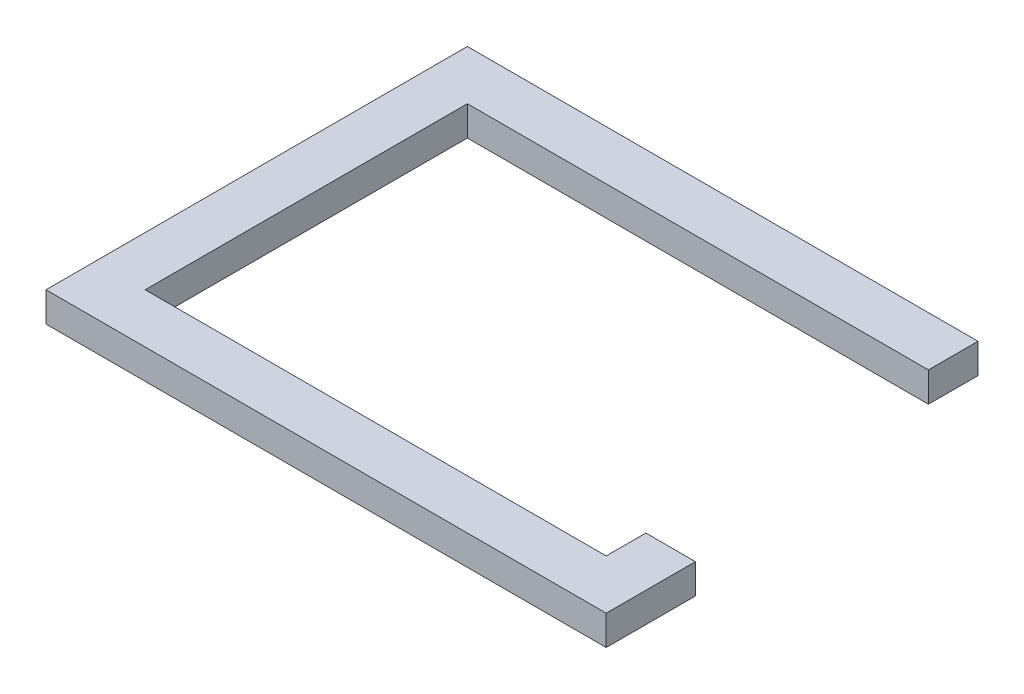
from build123d import *

# Parameters (mm, degrees)
BOSS_EXTRUDE1_DEPTH = 3


with BuildPart() as part:
    # Sketch1 → Boss-Extrude1 (new body)
    with BuildSketch(Plane(origin=(0, 0, 0), x_dir=(1, 0, 0), z_dir=(0, 1, 0))):
        Polygon((0, 0), (51.5, 0), (51.5, -5), (5, -5), (5, -37.5), (51.5, -37.5), (51.5, -33.5), (56.5, -33.5), (56.5, -42.5), (0, -42.5), align=None)
    extrude(amount=BOSS_EXTRUDE1_DEPTH)


solid = part.part
